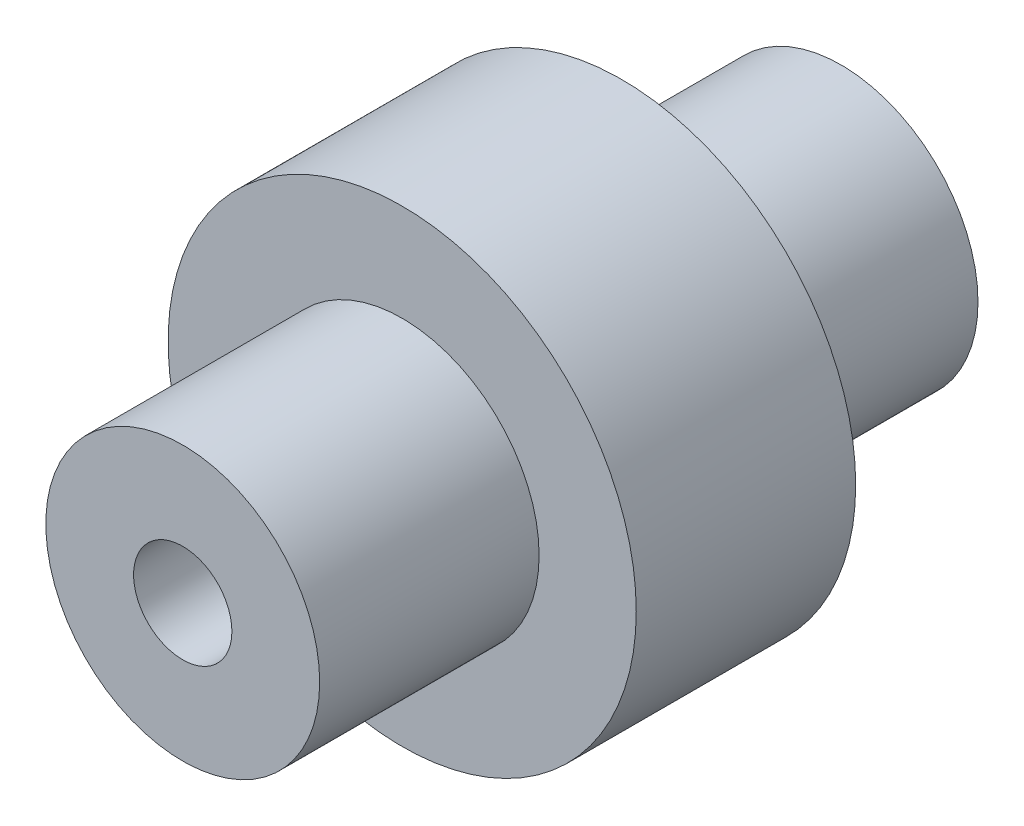
from build123d import *

# Parameters (mm, degrees)
SKETCH2_R           = 1.872
SKETCH2_R_2         = 0.672
BOSS_EXTRUDE1_DEPTH = 9
BOSS_EXTRUDE2_START = 3
SKETCH3_R           = 3.2
SKETCH3_R_2         = 1.872
BOSS_EXTRUDE2_DEPTH = 3


with BuildPart() as part:
    # Sketch2 → Boss-Extrude1 (new body)
    with BuildSketch(Plane.XY):
        Circle(SKETCH2_R)
        Circle(SKETCH2_R_2, mode=Mode.SUBTRACT)
    extrude(amount=BOSS_EXTRUDE1_DEPTH)

    # Sketch3 → Boss-Extrude2 (add)
    with BuildSketch(Plane.XY.offset(BOSS_EXTRUDE2_START)):
        Circle(SKETCH3_R)
        Circle(SKETCH3_R_2, mode=Mode.SUBTRACT)
    extrude(amount=BOSS_EXTRUDE2_DEPTH)


solid = part.part
